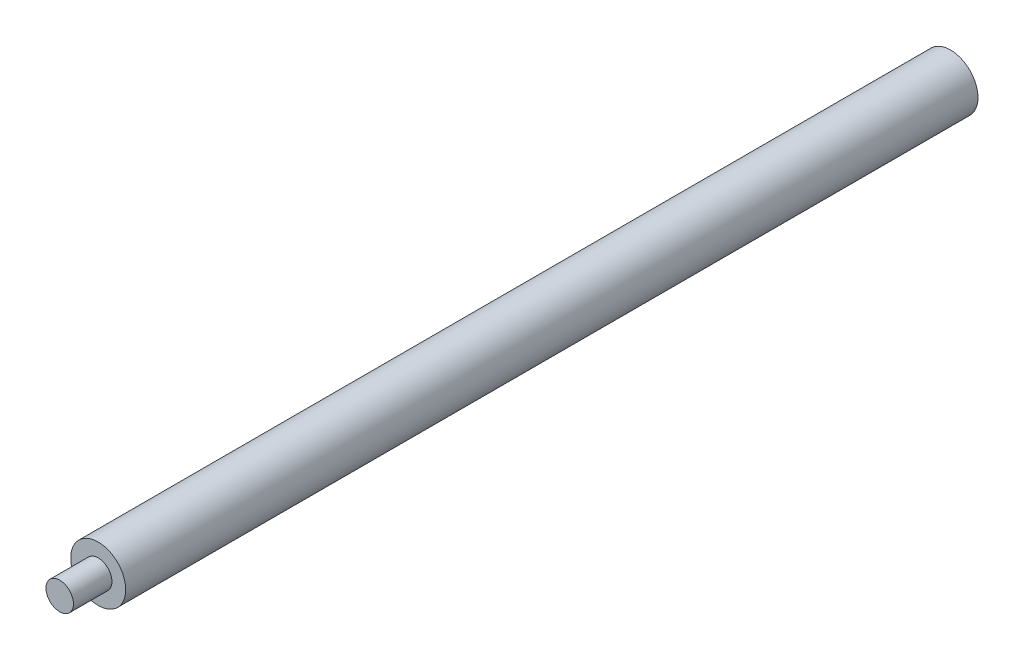
from build123d import *

# Parameters (mm, degrees)
SKETCH1_R           = 5
BOSS_EXTRUDE1_DEPTH = 155
SKETCH2_R           = 2.5
BOSS_EXTRUDE2_DEPTH = 7
SKETCH3_R           = 3
CUT_EXTRUDE1_DEPTH  = 10


with BuildPart() as part:
    # Sketch1 → Boss-Extrude1 (new body)
    with BuildSketch(Plane.XY):
        Circle(SKETCH1_R)
    extrude(amount=BOSS_EXTRUDE1_DEPTH)

    # Sketch2 → Boss-Extrude2 (add)
    with BuildSketch(Plane.XY.offset(155)):
        Circle(SKETCH2_R)
    extrude(amount=BOSS_EXTRUDE2_DEPTH)

    # Sketch3 → Cut-Extrude1 (cut)
    with BuildSketch(Plane(origin=(0, 0, 0), x_dir=(-1, 0, 0), z_dir=(0, 0, -1))):
        Circle(SKETCH3_R)
    extrude(amount=-CUT_EXTRUDE1_DEPTH, mode=Mode.SUBTRACT)


solid = part.part
